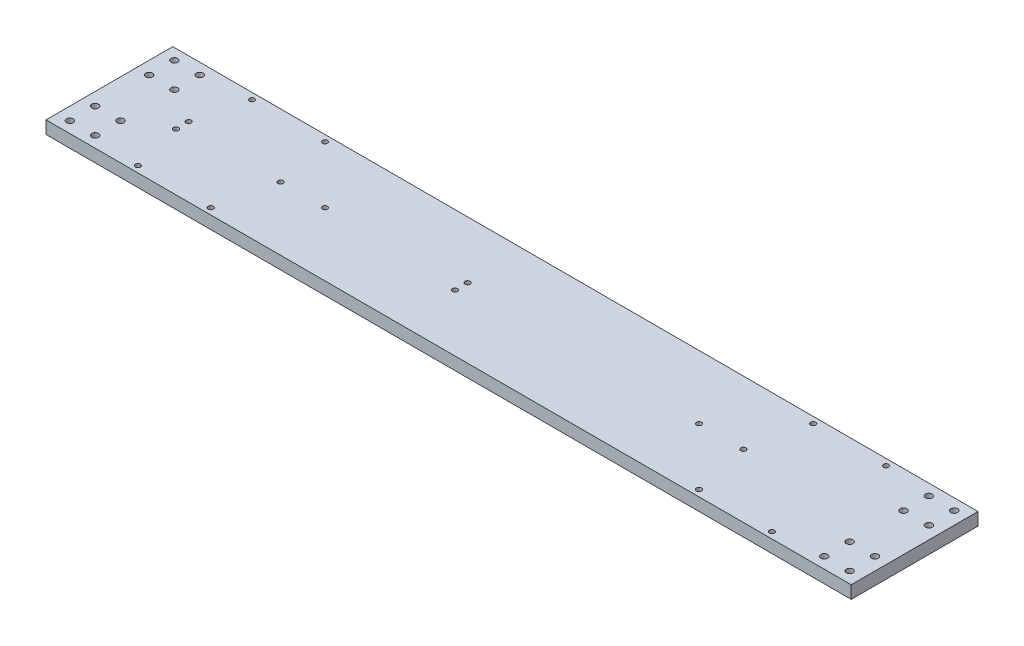
from build123d import *

# Parameters (mm, degrees)
SKETCH1_W                       = 806.45
SKETCH1_H                       = 127
BOSS_EXTRUDE1_DEPTH             = 12.7
F_1_4_CLEARANCE_HOLE1_D         = 6.7564
F_10_CLEARANCE_HOLE3_AT_2_COUNT = 2
F_10_CLEARANCE_HOLE3_AT_2_PITCH = 114.3
F_10_CLEARANCE_HOLE1_AT_2_COUNT = 2
F_10_CLEARANCE_HOLE1_AT_2_PITCH = 44.45
F_10_CLEARANCE_HOLE2_AT_2_COUNT = 2
F_10_CLEARANCE_HOLE2_AT_2_PITCH = 114.3
F_10_CLEARANCE_HOLE5_D          = 5.1054
F_10_CLEARANCE_HOLE5_DEPTH      = 12.7
F_10_CLEARANCE_HOLE5_TIP        = 1.533816902


with BuildPart() as part:
    # Sketch1 → Boss-Extrude1 (new body)
    with BuildSketch(Plane(origin=(0, 0, 0), x_dir=(1, 0, 0), z_dir=(0, 1, 0))):
        Rectangle(SKETCH1_W, SKETCH1_H)
    extrude(amount=BOSS_EXTRUDE1_DEPTH)

    # 1/4 Clearance Hole1 (through all)
    with Locations(Plane(origin=(0, 12.7, 0), x_dir=(1, 0, 0), z_dir=(0, 1, 0))):
        with Locations((365.125, 52.3875), (390.525, 26.9875), (365.125, 26.9875), (390.525, 52.3875), (365.125, -26.9875), (390.525, -52.3875), (365.125, -52.3875), (390.525, -26.9875)):
            f_1_4_clearance_hole1 = Hole(F_1_4_CLEARANCE_HOLE1_D / 2)

    # Sketch5 → #10 Clearance Hole3 (revolve, cut)
    with BuildSketch(Plane(origin=(317.5, 0, -57.15), x_dir=(0, 0, -1), z_dir=(1, 0, 0))):
        Polygon((0, 0), (0, 14.233816902), (2.5527, 12.7), (2.5527, 0), align=None)
    f_10_clearance_hole3 = revolve(axis=Axis((317.5, -6.35, -57.15), (0, 1, 0)), mode=Mode.SUBTRACT)

    # #10 Clearance Hole3 at 2: #10 Clearance Hole3 ×2
    with Locations(*[(0, 0, i * F_10_CLEARANCE_HOLE3_AT_2_PITCH) for i in range(1, F_10_CLEARANCE_HOLE3_AT_2_COUNT)]):
        add(f_10_clearance_hole3, mode=Mode.SUBTRACT)

    # Sketch9 → #10 Clearance Hole1 (revolve, cut)
    with BuildSketch(Plane(origin=(187.325, 0, 0), x_dir=(0, 0, -1), z_dir=(1, 0, 0))):
        Polygon((0, 0), (0, 14.233816902), (2.5527, 12.7), (2.5527, 0), align=None)
    f_10_clearance_hole1 = revolve(axis=Axis((187.325, -6.35, 0), (0, 1, 0)), mode=Mode.SUBTRACT)

    # #10 Clearance Hole1 at 2: #10 Clearance Hole1 ×2
    with Locations(*[(i * F_10_CLEARANCE_HOLE1_AT_2_PITCH, 0, 0) for i in range(1, F_10_CLEARANCE_HOLE1_AT_2_COUNT)]):
        add(f_10_clearance_hole1, mode=Mode.SUBTRACT)

    # Sketch13 → #10 Clearance Hole2 (revolve, cut)
    with BuildSketch(Plane(origin=(244.475, 0, -57.15), x_dir=(0, 0, -1), z_dir=(1, 0, 0))):
        Polygon((0, 0), (0, 14.233816902), (2.5527, 12.7), (2.5527, 0), align=None)
    f_10_clearance_hole2 = revolve(axis=Axis((244.475, -6.35, -57.15), (0, 1, 0)), mode=Mode.SUBTRACT)

    # #10 Clearance Hole2 at 2: #10 Clearance Hole2 ×2
    with Locations(*[(0, 0, i * F_10_CLEARANCE_HOLE2_AT_2_PITCH) for i in range(1, F_10_CLEARANCE_HOLE2_AT_2_COUNT)]):
        add(f_10_clearance_hole2, mode=Mode.SUBTRACT)

    # Mirror1: 1/4 Clearance Hole1, #10 Clearance Hole3, #10 Clearance Hole1, #10 Clearance Hole2 across plane
    add(f_1_4_clearance_hole1.mirror(Plane(origin=(0, 0, 0), x_dir=(0, 0, 1), z_dir=(1, 0, 0))), mode=Mode.SUBTRACT)
    add(f_10_clearance_hole3.mirror(Plane(origin=(0, 0, 0), x_dir=(0, 0, 1), z_dir=(1, 0, 0))), mode=Mode.SUBTRACT)
    add(f_10_clearance_hole1.mirror(Plane(origin=(0, 0, 0), x_dir=(0, 0, 1), z_dir=(1, 0, 0))), mode=Mode.SUBTRACT)
    add(f_10_clearance_hole2.mirror(Plane(origin=(0, 0, 0), x_dir=(0, 0, 1), z_dir=(1, 0, 0))), mode=Mode.SUBTRACT)

    # Mirror1 copy 1 sketch → Mirror1 copy 1 (revolve, cut)
    with BuildSketch(Plane(origin=(-317.5, 0, 57.15), x_dir=(0, 0, -1), z_dir=(-1, 0, 0))):
        Polygon((0, 0), (0, -14.233816902), (2.5527, -12.7), (2.5527, 0), align=None)
    revolve(axis=Axis((-317.5, -6.35, 57.15), (0, -1, 0)), mode=Mode.SUBTRACT)

    # Mirror1 copy 2 sketch → Mirror1 copy 2 (revolve, cut)
    with BuildSketch(Plane(origin=(-231.775, 0, 0), x_dir=(0, 0, -1), z_dir=(-1, 0, 0))):
        Polygon((0, 0), (0, -14.233816902), (2.5527, -12.7), (2.5527, 0), align=None)
    revolve(axis=Axis((-231.775, -6.35, 0), (0, -1, 0)), mode=Mode.SUBTRACT)

    # Mirror1 copy 3 sketch → Mirror1 copy 3 (revolve, cut)
    with BuildSketch(Plane(origin=(-244.475, 0, 57.15), x_dir=(0, 0, -1), z_dir=(-1, 0, 0))):
        Polygon((0, 0), (0, -14.233816902), (2.5527, -12.7), (2.5527, 0), align=None)
    revolve(axis=Axis((-244.475, -6.35, 57.15), (0, -1, 0)), mode=Mode.SUBTRACT)

    # #10 Clearance Hole5
    with Locations(Plane(origin=(0, 12.7, 0), x_dir=(1, 0, 0), z_dir=(0, 1, 0))):
        with Locations((-50.8, 6.35), (-50.8, -6.35), (-330.2, 6.35), (-330.2, -6.35)):
            Hole(F_10_CLEARANCE_HOLE5_D / 2, depth=F_10_CLEARANCE_HOLE5_DEPTH)
            with Locations((0, 0, -(F_10_CLEARANCE_HOLE5_DEPTH + F_10_CLEARANCE_HOLE5_TIP / 2))):  # 118° drill point
                Cone(0, F_10_CLEARANCE_HOLE5_D / 2, F_10_CLEARANCE_HOLE5_TIP, mode=Mode.SUBTRACT)


solid = part.part
